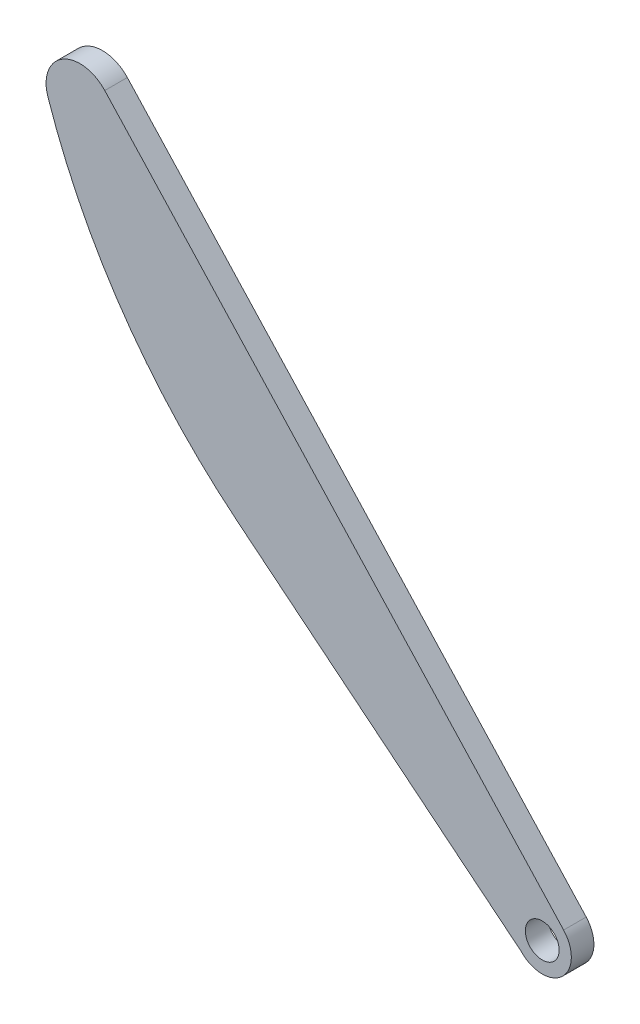
from build123d import *

# Parameters (mm, degrees)
SKETCH1_R           = 1.5
BOSS_EXTRUDE1_DEPTH = 2
FILLET1_R           = 3


with BuildPart() as part:
    # Sketch1 → Boss-Extrude1 (new body)
    with BuildSketch(Plane.XY):
        with BuildLine():
            Line((-46.636509162, 42.789020236), (-50.060973508, 46.502785938))
            Line((-50.060973508, 46.502785938), (-86.522855439, 86.04499543))
            Line((-86.522855439, 86.04499543), (-94.837872086, 95.062471017))
            ThreePointArc((-94.837872086, 95.062471017), (-88.687933444, 75.487292789), (-75.566721617, 59.712529776))
            Line((-75.566721617, 59.712529776), (-50.429932547, 39.291103519))
            ThreePointArc((-50.429932547, 39.291103519), (-46.784262496, 39.143350184), (-46.636509162, 42.789020236))
        make_face()
        with Locations((-48.533220855, 41.040061877)):
            Circle(SKETCH1_R, mode=Mode.SUBTRACT)
    extrude(amount=BOSS_EXTRUDE1_DEPTH)

    # Fillet1
    fillet1_edges = [part.edges().sort_by_distance(p)[0] for p in [
        (-94.837872086, 95.062471017, 1),
    ]]
    fillet(fillet1_edges, radius=FILLET1_R)


solid = part.part
